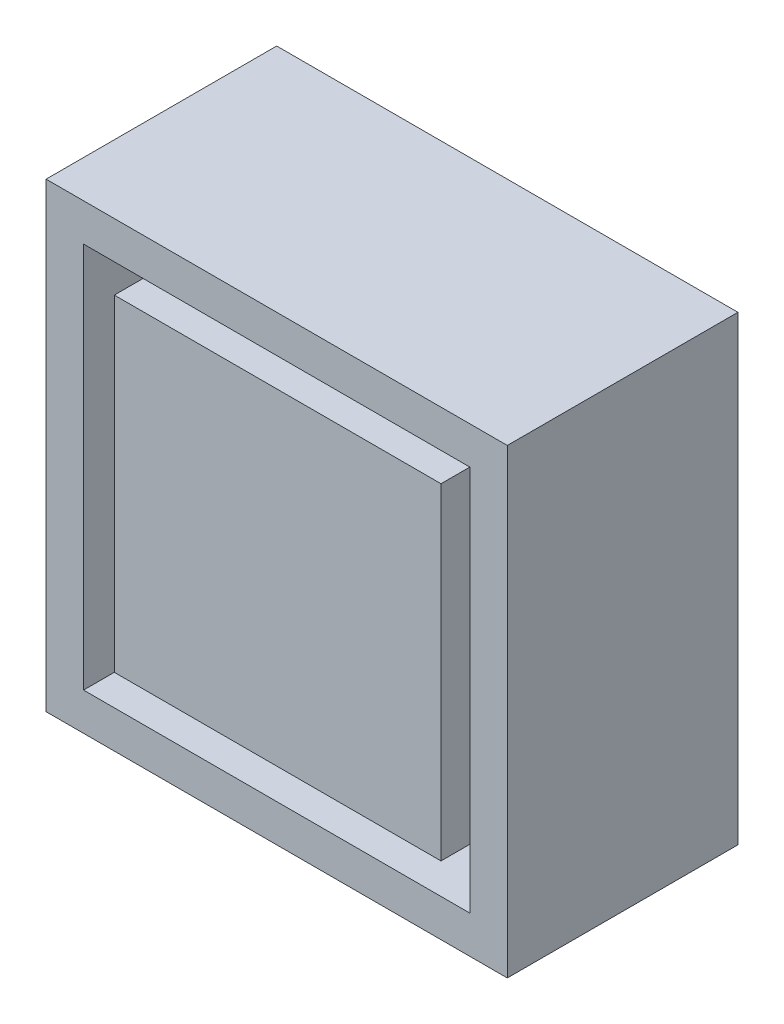
from build123d import *

# Parameters (mm, degrees)
SKETCH_1_W      = 24
SKETCH_1_H      = 24
EXTRUDE_5_DEPTH = 12
SHELL_2_T       = -1.95
SKETCH_5_W      = 17
SKETCH_5_H      = 17
EXTRUDE_6_DEPTH = 10


with BuildPart() as part:
    # ｽｹｯﾁ1 → ﾎﾞｽ - 押し出し5 (new body)
    with BuildSketch(Plane.XY):
        with Locations((12, 12)):
            Rectangle(SKETCH_1_W, SKETCH_1_H)
    extrude(amount=EXTRUDE_5_DEPTH)

    # ｼｪﾙ2
    shell_2_openings = [part.faces().sort_by_distance(p)[0] for p in [
        (12, 12, 12),
    ]]
    offset(amount=SHELL_2_T, openings=shell_2_openings, kind=Kind.INTERSECTION)

    # ｽｹｯﾁ5 → ﾎﾞｽ - 押し出し6 (add)
    with BuildSketch(Plane.XY.offset(1.95)):
        with Locations((12, 12)):
            Rectangle(SKETCH_5_W, SKETCH_5_H)
    extrude(amount=EXTRUDE_6_DEPTH)


solid = part.part
